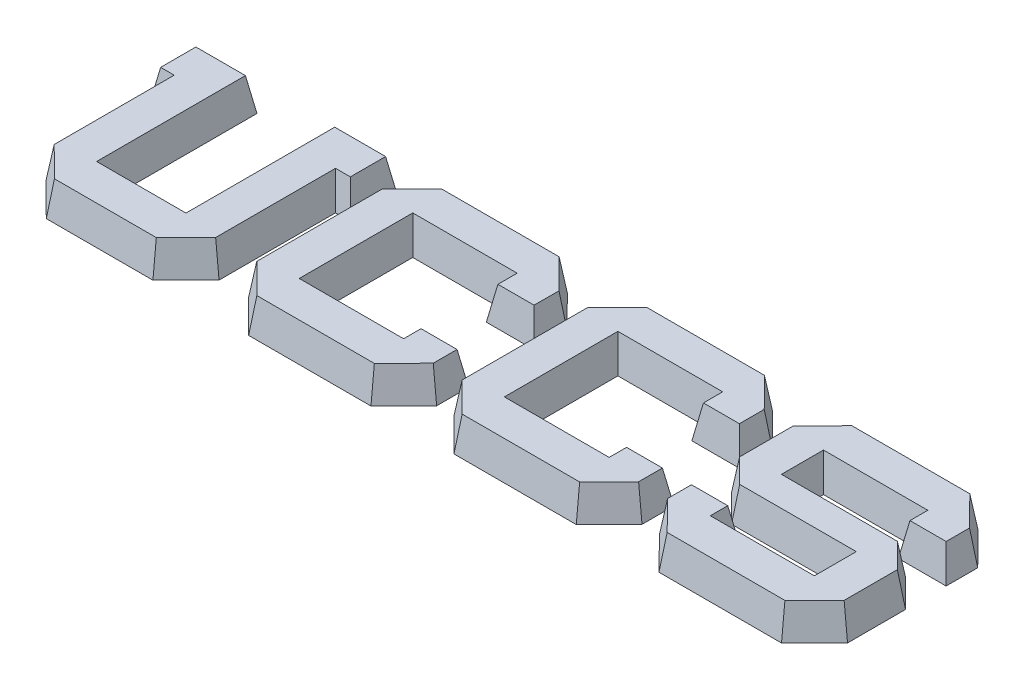
from build123d import *

# Parameters (mm, degrees)
BOSS_EXTRUDE1_DEPTH           = 4
BOSS_EXTRUDE1_DRAFT           = 10
BOSS_EXTRUDE1_PROFILE_2_DEPTH = 4
BOSS_EXTRUDE1_PROFILE_2_DRAFT = 10
BOSS_EXTRUDE1_PROFILE_3_DEPTH = 4
BOSS_EXTRUDE1_PROFILE_3_DRAFT = 10
BOSS_EXTRUDE1_PROFILE_4_DEPTH = 4
BOSS_EXTRUDE1_PROFILE_4_DRAFT = 10
SKETCH3_R                     = 1.127
CUT_EXTRUDE1_DEPTH            = 2.01


with BuildPart() as part:
    # Sketch2 → Boss-Extrude1 (with draft: the straight prism first)
    with BuildSketch(Plane(origin=(0, 0, 0), x_dir=(1, 0, 0), z_dir=(0, 1, 0))):
        Polygon((97.7281764, 36.0482388), (82.7685416, 36.0415332), (78.810231, 32.0159888), (78.810231, 24.9192542), (82.1301126, 21.6060782), (95.9203822, 21.6128092), (95.9203822, 17.9165758), (84.6502498, 17.9165758), (84.6502498, 20.040219), (78.8169366, 20.040219), (78.8169366, 16.1423858), (82.7752726, 12.1168668), (97.7147398, 12.1168668), (101.7335278, 16.1423858), (101.7335278, 23.2122726), (98.3262956, 26.6195048), (84.60994, 26.6195048), (84.60994, 30.3359058), (95.9136766, 30.3359058), (95.9136766, 28.1584908), (101.7335278, 28.1584908), (101.7335278, 32.0092832), align=None)
    extrude(amount=BOSS_EXTRUDE1_DEPTH)
    # Boss-Extrude1: the draft: its side faces are tilted about the plane it starts from
    boss_extrude1_sides = [part.faces().sort_by_distance(p)[0] for p in [
        (90.248359, 2, -36.044886),
        (80.7893863, 2, -34.028761),
        (78.810231, 2, -28.4676215),
        (80.4701718, 2, -23.2626662),
        (89.0252474, 2, -21.6094437),
        (95.9203822, 2, -19.7646925),
        (90.285316, 2, -17.9165758),
        (84.6502498, 2, -18.9783974),
        (81.7335932, 2, -20.040219),
        (78.8169366, 2, -18.0913024),
        (80.7961046, 2, -14.1296263),
        (90.2450062, 2, -12.1168668),
        (99.7241338, 2, -14.1296263),
        (101.7335278, 2, -19.6773292),
        (100.0299117, 2, -24.9158887),
        (91.4681178, 2, -26.6195048),
        (84.60994, 2, -28.4777053),
        (90.2618083, 2, -30.3359058),
        (95.9136766, 2, -29.2471983),
        (98.8236022, 2, -28.1584908),
        (101.7335278, 2, -30.083887),
        (99.7308521, 2, -34.028761),
    ]]
    draft(boss_extrude1_sides, Plane(origin=(0, 0, 0), x_dir=(1, 0, 0), z_dir=(0, 1, 0)), BOSS_EXTRUDE1_DRAFT)


with BuildPart() as body_2:
    # Sketch2 → Boss-Extrude1 profile 2 (with draft: the straight prism first)
    with BuildSketch(Plane(origin=(0, 0, 0), x_dir=(1, 0, 0), z_dir=(0, 1, 0))):
        Polygon((72.7080842, 36.0348022), (57.8022212, 36.0348022), (53.7901388, 32.0092832), (53.7834332, 16.1289492), (57.8022212, 12.1101358), (72.7080842, 12.1101358), (76.6932934, 16.1356802), (76.6932934, 20.0335134), (70.913752, 20.0335134), (70.913752, 17.9098702), (59.556269, 17.9098702), (59.556269, 30.3359058), (70.913752, 30.3359058), (70.913752, 27.9904698), (76.70673, 27.9904698), (76.70673, 32.0159888), align=None)
    extrude(amount=BOSS_EXTRUDE1_PROFILE_2_DEPTH)
    # Boss-Extrude1 profile 2: the draft: its side faces are tilted about the plane it starts from
    boss_extrude1_profile_2_sides = [body_2.faces().sort_by_distance(p)[0] for p in [
        (65.2551527, 2, -36.0348022),
        (55.79618, 2, -34.0220427),
        (53.786786, 2, -24.0691162),
        (55.7928272, 2, -14.1195425),
        (65.2551527, 2, -12.1101358),
        (74.7006888, 2, -14.122908),
        (76.6932934, 2, -18.0845968),
        (73.8035227, 2, -20.0335134),
        (70.913752, 2, -18.9716918),
        (65.2350105, 2, -17.9098702),
        (59.556269, 2, -24.122888),
        (65.2350105, 2, -30.3359058),
        (70.913752, 2, -29.1631878),
        (73.810241, 2, -27.9904698),
        (76.70673, 2, -30.0032293),
        (74.7074071, 2, -34.0253955),
    ]]
    draft(boss_extrude1_profile_2_sides, Plane(origin=(0, 0, 0), x_dir=(1, 0, 0), z_dir=(0, 1, 0)), BOSS_EXTRUDE1_PROFILE_2_DRAFT)


with BuildPart() as body_3:
    # Sketch2 → Boss-Extrude1 profile 3 (with draft: the straight prism first)
    with BuildSketch(Plane(origin=(0, 0, 0), x_dir=(1, 0, 0), z_dir=(0, 1, 0))):
        Polygon((47.6880174, 36.0348022), (32.7821544, 36.0348022), (28.763341, 32.0092832), (28.7566354, 16.1289492), (32.7821544, 12.1101358), (47.6880174, 12.1101358), (51.6664956, 16.1356802), (51.6664956, 20.0335134), (45.8667866, 20.0335134), (45.8667866, 17.9098702), (34.5563444, 17.9098702), (34.5563444, 30.3359058), (45.8667866, 30.3359058), (45.8667866, 27.9904698), (51.6799322, 27.9904698), (51.6933688, 32.0159888), align=None)
    extrude(amount=BOSS_EXTRUDE1_PROFILE_3_DEPTH)
    # Boss-Extrude1 profile 3: the draft: its side faces are tilted about the plane it starts from
    boss_extrude1_profile_3_sides = [body_3.faces().sort_by_distance(p)[0] for p in [
        (40.2350859, 2, -36.0348022),
        (30.7727477, 2, -34.0220427),
        (28.7599882, 2, -24.0691162),
        (30.7693949, 2, -14.1195425),
        (40.2350859, 2, -12.1101358),
        (49.6772565, 2, -14.122908),
        (51.6664956, 2, -18.0845968),
        (48.7666411, 2, -20.0335134),
        (45.8667866, 2, -18.9716918),
        (40.2115655, 2, -17.9098702),
        (34.5563444, 2, -24.122888),
        (40.2115655, 2, -30.3359058),
        (45.8667866, 2, -29.1631878),
        (48.7733594, 2, -27.9904698),
        (51.6866505, 2, -30.0032293),
        (49.6906931, 2, -34.0253955),
    ]]
    draft(boss_extrude1_profile_3_sides, Plane(origin=(0, 0, 0), x_dir=(1, 0, 0), z_dir=(0, 1, 0)), BOSS_EXTRUDE1_PROFILE_3_DRAFT)


with BuildPart() as body_4:
    # Sketch2 → Boss-Extrude1 profile 4 (with draft: the straight prism first)
    with BuildSketch(Plane(origin=(0, 0, 0), x_dir=(1, 0, 0), z_dir=(0, 1, 0))):
        Polygon((26.9488412, 36.0415332), (19.341338, 36.0415332), (19.341338, 17.9098702), (9.8655632, 17.9098702), (9.8655632, 36.0415332), (2.41935, 36.0415332), (2.41935, 30.3359058), (4.0725598, 30.3359058), (4.0725598, 16.1222182), (8.1249774, 12.1034302), (21.1222336, 12.1034302), (25.141047, 16.1423858), (25.141047, 30.3359058), (26.9488412, 30.3359058), align=None)
    extrude(amount=BOSS_EXTRUDE1_PROFILE_4_DEPTH)
    # Boss-Extrude1 profile 4: the draft: its side faces are tilted about the plane it starts from
    boss_extrude1_profile_4_sides = [body_4.faces().sort_by_distance(p)[0] for p in [
        (23.1450896, 2, -36.0415332),
        (19.341338, 2, -26.9757017),
        (14.6034506, 2, -17.9098702),
        (9.8655632, 2, -26.9757017),
        (6.1424566, 2, -36.0415332),
        (2.41935, 2, -33.1887195),
        (3.2459549, 2, -30.3359058),
        (4.0725598, 2, -23.229062),
        (6.0987686, 2, -14.1128242),
        (14.6236055, 2, -12.1034302),
        (23.1316403, 2, -14.122908),
        (25.141047, 2, -23.2391458),
        (26.0449441, 2, -30.3359058),
        (26.9488412, 2, -33.1887195),
    ]]
    draft(boss_extrude1_profile_4_sides, Plane(origin=(0, 0, 0), x_dir=(1, 0, 0), z_dir=(0, 1, 0)), BOSS_EXTRUDE1_PROFILE_4_DRAFT)


with BuildPart() as cut_extrude1_tool:
    # Sketch3 → Cut-Extrude1 (new body)
    with BuildSketch(Plane.XZ):
        with Locations(Location((90.763324993, -33.141385623, 0), (0, 0, 270))):
            Circle(SKETCH3_R)
        with Locations(Location((90.763324993, -15.003552377, 0), (0, 0, 270))):
            Circle(SKETCH3_R)
        with Locations(Location((65.722893132, -15.003552377, 0), (0, 0, 270))):
            Circle(SKETCH3_R)
        with Locations(Location((65.722893132, -33.141385623, 0), (0, 0, 270))):
            Circle(SKETCH3_R)
        with Locations(Location((40.112697061, -33.141385623, 0), (0, 0, 270))):
            Circle(SKETCH3_R)
        with Locations(Location((40.112697061, -15.003552377, 0), (0, 0, 270))):
            Circle(SKETCH3_R)
        with Locations(Location((21.962610877, -21.990115777, 0), (0, 0, 270))):
            Circle(SKETCH3_R)
        with Locations(Location((6.962610877, -21.990115777, 0), (0, 0, 270))):
            Circle(SKETCH3_R)
    extrude(amount=-CUT_EXTRUDE1_DEPTH)


with BuildPart() as part_1:
    add(part.part)

    # Cut-Extrude1: cut by cut_extrude1_tool
    add(cut_extrude1_tool.part, mode=Mode.SUBTRACT)


with BuildPart() as body_2_1:
    add(body_2.part)

    # Cut-Extrude1: cut by cut_extrude1_tool
    add(cut_extrude1_tool.part, mode=Mode.SUBTRACT)


with BuildPart() as body_3_1:
    add(body_3.part)

    # Cut-Extrude1: cut by cut_extrude1_tool
    add(cut_extrude1_tool.part, mode=Mode.SUBTRACT)


with BuildPart() as body_4_1:
    add(body_4.part)

    # Cut-Extrude1: cut by cut_extrude1_tool
    add(cut_extrude1_tool.part, mode=Mode.SUBTRACT)


solid = Compound([part_1.part, body_2_1.part, body_3_1.part, body_4_1.part])
